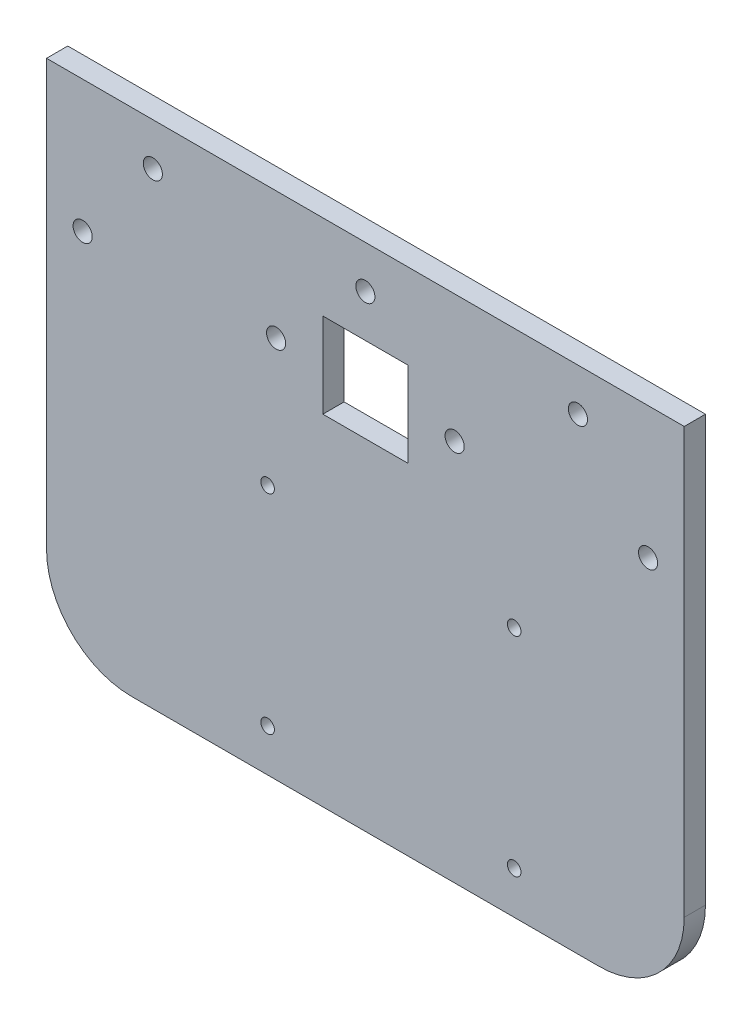
from build123d import *

# Parameters (mm, degrees)
ESQUISSE1_R        = 1.6
ESQUISSE1_R_2      = 2.25
ESQUISSE1_W        = 20
ESQUISSE1_H        = 20
BOSS_EXTRU_1_DEPTH = 5


with BuildPart() as part:
    # Esquisse1 → Boss.-Extru.1 (new body)
    with BuildSketch(Plane.XY):
        with BuildLine():
            Line((0, 0), (150, 0))
            Line((150, 0), (150, -100))
            ThreePointArc((150, -100), (144.142135624, -114.142135624), (130, -120))
            Line((130, -120), (20, -120))
            ThreePointArc((20, -120), (5.857864376, -114.142135624), (0, -100))
            Line((0, -100), (0, 0))
        make_face()
        with Locations((52, -61)):
            Circle(ESQUISSE1_R, mode=Mode.SUBTRACT)
        with Locations((110, -61)):
            Circle(ESQUISSE1_R, mode=Mode.SUBTRACT)
        with Locations((110, -110)):
            Circle(ESQUISSE1_R, mode=Mode.SUBTRACT)
        with Locations((52, -110)):
            Circle(ESQUISSE1_R, mode=Mode.SUBTRACT)
        with Locations((8.5, -31)):
            Circle(ESQUISSE1_R_2, mode=Mode.SUBTRACT)
        with Locations((141.5, -31)):
            Circle(ESQUISSE1_R_2, mode=Mode.SUBTRACT)
        with Locations((25, -10)):
            Circle(ESQUISSE1_R_2, mode=Mode.SUBTRACT)
        with Locations((125, -10)):
            Circle(ESQUISSE1_R_2, mode=Mode.SUBTRACT)
        with Locations((96, -30)):
            Circle(ESQUISSE1_R_2, mode=Mode.SUBTRACT)
        with Locations((54, -30)):
            Circle(ESQUISSE1_R_2, mode=Mode.SUBTRACT)
        with Locations((75, -10)):
            Circle(ESQUISSE1_R_2, mode=Mode.SUBTRACT)
        with Locations((75, -30)):
            Rectangle(ESQUISSE1_W, ESQUISSE1_H, mode=Mode.SUBTRACT)
    extrude(amount=BOSS_EXTRU_1_DEPTH)


solid = part.part
